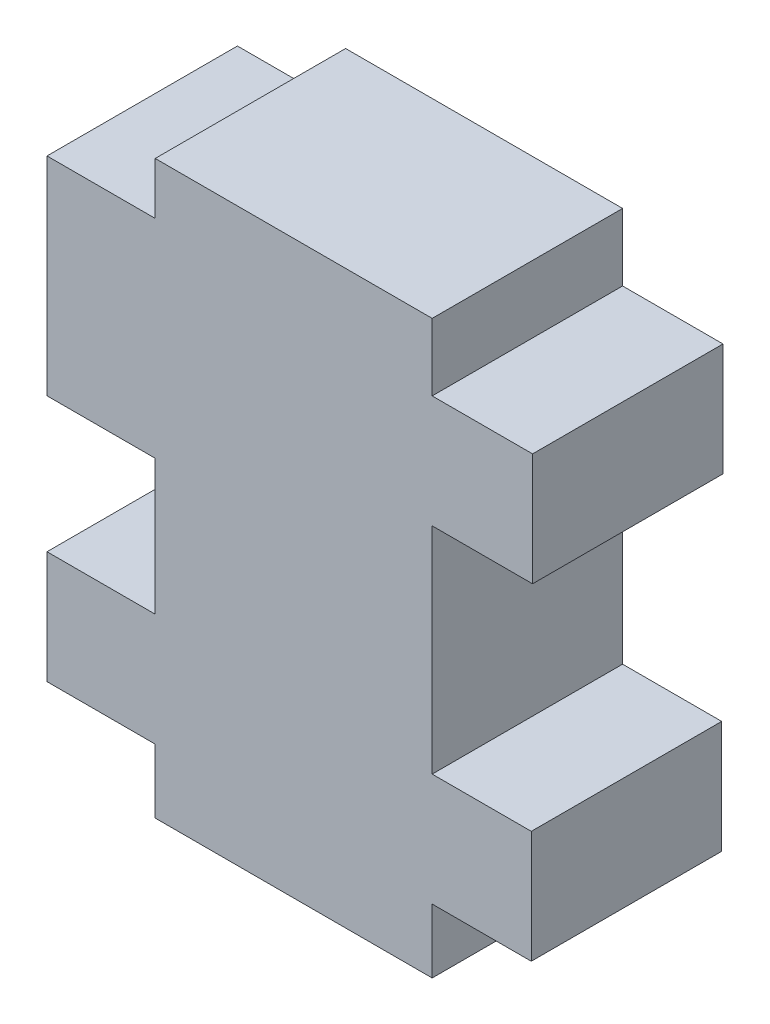
from build123d import *

# Parameters (mm, degrees)
COMPONENT_OUTLINE_DEPTH = 1.1


with BuildPart() as part:
    # 草图1 → Component_Outline (new body)
    with BuildSketch(Plane.XY):
        Polygon((-1.425, 1.35), (-0.8, 1.35), (-0.8, 1.65), (0.8, 1.65), (0.8, 1.262), (1.38, 1.262), (1.38, 0.612), (0.8, 0.612), (0.8, -0.63), (1.3725, -0.63), (1.3725, -1.28), (0.8, -1.28), (0.8, -1.65), (-0.8, -1.65), (-0.8, -1.28), (-1.425, -1.28), (-1.425, -0.63), (-0.8, -0.63), (-0.8, 0.15), (-1.425, 0.15), align=None)
    extrude(amount=COMPONENT_OUTLINE_DEPTH)


solid = part.part
